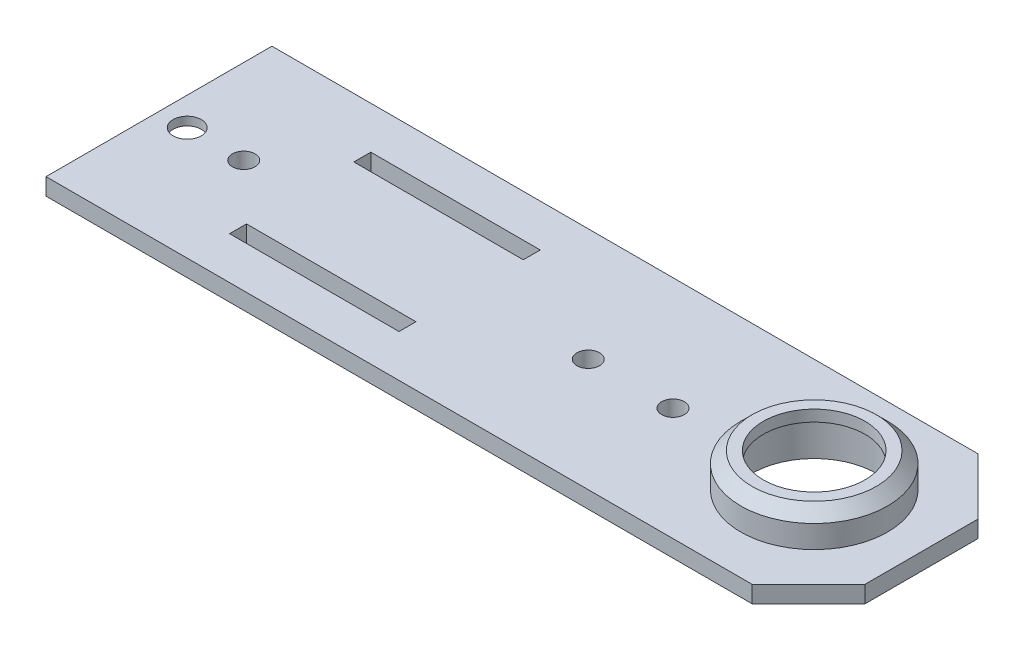
from build123d import *

# Parameters (mm, degrees)
CROQUIS1_R              = 11
CROQUIS1_R_2            = 2
CROQUIS1_W              = 30
CROQUIS1_H              = 3
SALIENTE_EXTRUIR1_DEPTH = 3
CROQUIS2_R              = 13
CROQUIS2_R_2            = 11
SALIENTE_EXTRUIR2_DEPTH = 4
CROQUIS3_R              = 13
CROQUIS3_R_2            = 9
SALIENTE_EXTRUIR3_DEPTH = 2
CHAFL_N1_SIZE           = 2
CHAFL_N2_SIZE           = 10
CROQUIS4_W              = 10
CROQUIS4_H              = 20
CROQUIS4_R              = 2.5
SALIENTE_EXTRUIR4_DEPTH = 1.5


with BuildPart() as part:
    # Croquis1 → Saliente-Extruir1 (new body)
    with BuildSketch(Plane(origin=(0, 0, 0), x_dir=(1, 0, 0), z_dir=(0, 1, 0))):
        Polygon((-67.5, -20), (67.5, -20), (67.5, 20), (-67.5, 20), (-67.5, 10), (-57.5, 10), (-57.5, -10), (-67.5, -10), align=None)
        with Locations(Location((48.5, 0, 0), (0, 0, 270))):
            Circle(CROQUIS1_R, mode=Mode.SUBTRACT)
        with Locations(Location((-52.5, 0, 0), (0, 0, 270))):
            Circle(CROQUIS1_R_2, mode=Mode.SUBTRACT)
        with Locations(Location((23.5, 0, 0), (0, 0, 270))):
            Circle(CROQUIS1_R_2, mode=Mode.SUBTRACT)
        with Locations(Location((8.5, 0, 0), (0, 0, 270))):
            Circle(CROQUIS1_R_2, mode=Mode.SUBTRACT)
        with Locations((-27.5, 11)):
            Rectangle(CROQUIS1_W, CROQUIS1_H, mode=Mode.SUBTRACT)
        with Locations((-27.5, -11)):
            Rectangle(CROQUIS1_W, CROQUIS1_H, mode=Mode.SUBTRACT)
    extrude(amount=SALIENTE_EXTRUIR1_DEPTH)

    # Croquis2 → Saliente-Extruir2 (add)
    with BuildSketch(Plane(origin=(0, 3, 0), x_dir=(1, 0, 0), z_dir=(0, 1, 0))):
        with Locations(Location((48.5, 0, 0), (0, 0, 90))):
            Circle(CROQUIS2_R)
        with Locations(Location((48.5, 0, 0), (0, 0, 270))):
            Circle(CROQUIS2_R_2, mode=Mode.SUBTRACT)
    extrude(amount=SALIENTE_EXTRUIR2_DEPTH)

    # Croquis3 → Saliente-Extruir3 (add)
    with BuildSketch(Plane(origin=(0, 7, 0), x_dir=(1, 0, 0), z_dir=(0, 1, 0))):
        with Locations(Location((48.5, 0, 0), (0, 0, 90))):
            Circle(CROQUIS3_R)
        with Locations(Location((48.5, 0, 0), (0, 0, 270))):
            Circle(CROQUIS3_R_2, mode=Mode.SUBTRACT)
    extrude(amount=SALIENTE_EXTRUIR3_DEPTH)

    # Chaflán1
    chafl_n1_edges = [part.edges().sort_by_distance(p)[0] for p in [
        (48.5, 9, 13),
    ]]
    chamfer(chafl_n1_edges, length=CHAFL_N1_SIZE)

    # Chaflán2
    chafl_n2_edges = [part.edges().sort_by_distance(p)[0] for p in [
        (67.5, 1.5, 20),
        (67.5, 1.5, -20),
    ]]
    chamfer(chafl_n2_edges, length=CHAFL_N2_SIZE)

    # Croquis4 → Saliente-Extruir4 (add)
    with BuildSketch(Plane(origin=(0, 3, 0), x_dir=(1, 0, 0), z_dir=(0, 1, 0))):
        with Locations((-62.5, 0)):
            Rectangle(CROQUIS4_W, CROQUIS4_H)
        with Locations(Location((-62.5, 0, 0), (0, 0, 270))):
            Circle(CROQUIS4_R, mode=Mode.SUBTRACT)
    extrude(amount=-SALIENTE_EXTRUIR4_DEPTH)


solid = part.part
